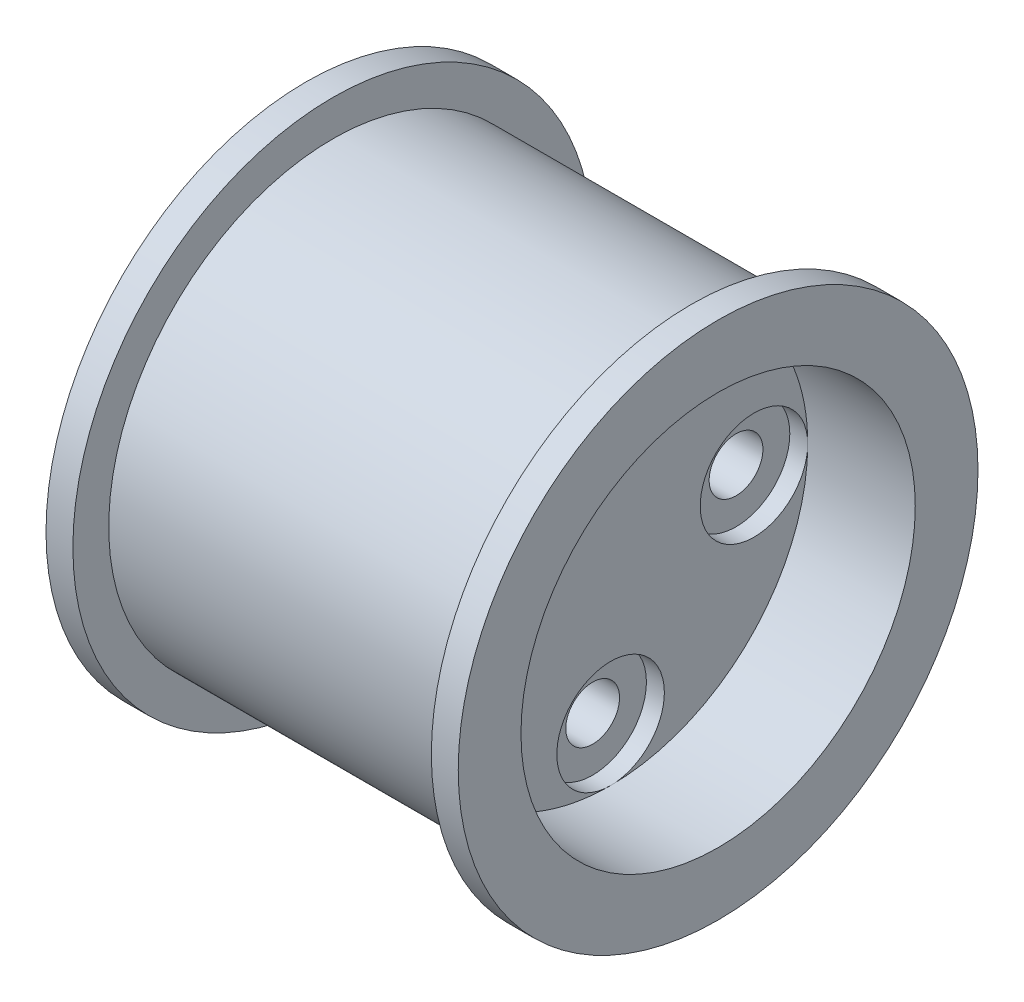
from build123d import *

# Parameters (mm, degrees)
SKETCH1_R           = 14.5
BOSS_EXTRUDE1_DEPTH = 1.5
SKETCH2_R           = 12.5
BOSS_EXTRUDE2_DEPTH = 20
SKETCH3_R           = 14.5
BOSS_EXTRUDE3_DEPTH = 1.5
SKETCH4_R           = 11
CUT_EXTRUDE1_DEPTH  = 6
SKETCH5_R           = 1.5
CUT_EXTRUDE2_DEPTH  = 17
SKETCH6_R           = 3
CUT_EXTRUDE3_DEPTH  = 1


with BuildPart() as part:
    # Sketch1 → Boss-Extrude1 (new body)
    with BuildSketch(Plane(origin=(0, 0, 0), x_dir=(0, 0, -1), z_dir=(1, 0, 0))):
        Circle(SKETCH1_R)
    extrude(amount=BOSS_EXTRUDE1_DEPTH)

    # Sketch2 → Boss-Extrude2 (add)
    with BuildSketch(Plane(origin=(1.5, 0, 0), x_dir=(0, 0, -1), z_dir=(1, 0, 0))):
        Circle(SKETCH2_R)
    extrude(amount=BOSS_EXTRUDE2_DEPTH)

    # Sketch3 → Boss-Extrude3 (add)
    with BuildSketch(Plane(origin=(21.5, 0, 0), x_dir=(0, 0, -1), z_dir=(1, 0, 0))):
        Circle(SKETCH3_R)
    extrude(amount=BOSS_EXTRUDE3_DEPTH)

    # Sketch4 → Cut-Extrude1 (cut)
    with BuildSketch(Plane(origin=(23, 0, 0), x_dir=(0, 0, -1), z_dir=(1, 0, 0))):
        Circle(SKETCH4_R)
    extrude(amount=-CUT_EXTRUDE1_DEPTH, mode=Mode.SUBTRACT)

    # Sketch5 → Cut-Extrude2 (cut)
    with BuildSketch(Plane(origin=(17, 0, 0), x_dir=(0, 0, -1), z_dir=(1, 0, 0))):
        with Locations((0, 8)):
            Circle(SKETCH5_R)
        with Locations((8, 0)):
            Circle(SKETCH5_R)
        with Locations((0, -8)):
            Circle(SKETCH5_R)
        with Locations((-8, 0)):
            Circle(SKETCH5_R)
    extrude(amount=-CUT_EXTRUDE2_DEPTH, mode=Mode.SUBTRACT)

    # Sketch6 → Cut-Extrude3 (cut)
    with BuildSketch(Plane(origin=(17, 0, 0), x_dir=(0, 0, -1), z_dir=(1, 0, 0))):
        with Locations((0, 8)):
            Circle(SKETCH6_R)
        with Locations((8, 0)):
            Circle(SKETCH6_R)
        with Locations((0, -8)):
            Circle(SKETCH6_R)
        with Locations((-8, 0)):
            Circle(SKETCH6_R)
    extrude(amount=-CUT_EXTRUDE3_DEPTH, mode=Mode.SUBTRACT)


solid = part.part
